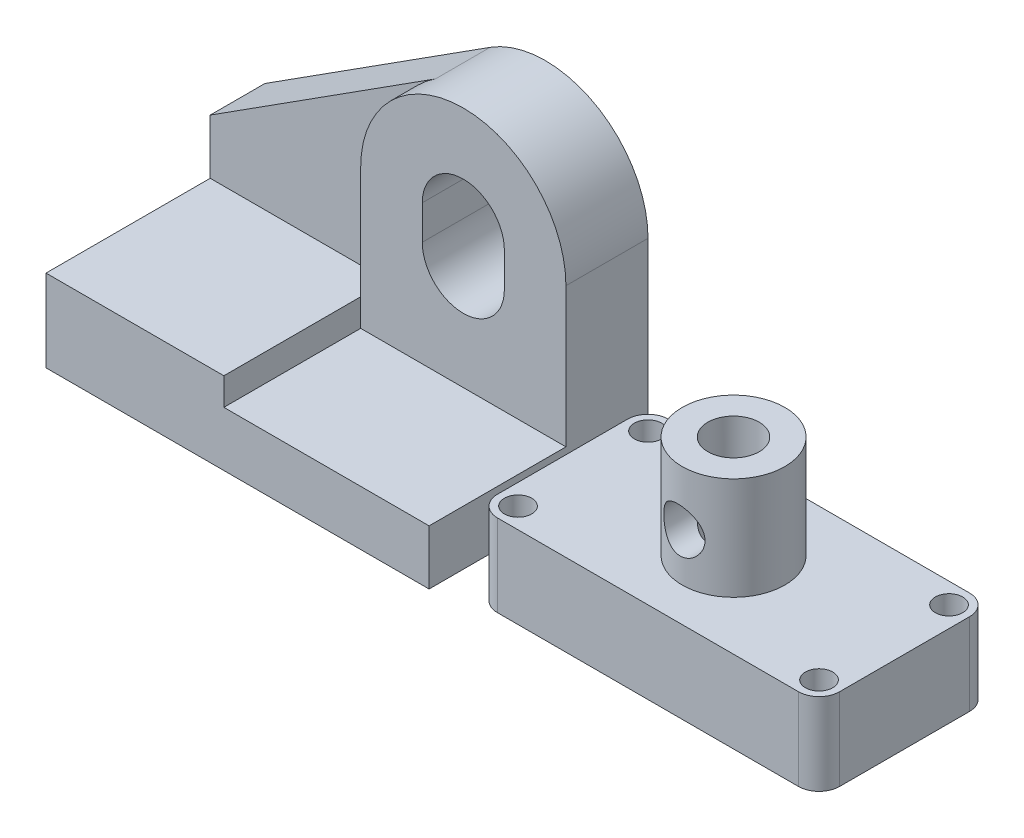
from build123d import *

# Parameters (mm, degrees)
EXTRUDE_1_DEPTH          = 32
EXTRUDE_2_DEPTH          = 8
EXTRUDE_3_DEPTH          = 12
SKETCH_2_R               = 2
EXTRUDE_4_DEPTH          = 12
SKETCH_3_R               = 7.5
SKETCH_3_R_2             = 3.75
EXTRUDE_5_DEPTH          = 15
SKETCH_3_5_R             = 3.75
CUT_EXTRUDE_2_DEPTH      = 15
CUT_EXTRUDE_3_DEPTH      = 15
CUT_EXTRUDE_3_DEPTH_BACK = 15
SKETCH_7_R               = 3.210770443


with BuildPart() as part:
    # 草图1 → 凸台-拉伸1 (new body)
    with BuildSketch(Plane.XY):
        Polygon((0, 12), (0, 0), (56, 0), (56, 8), (26, 8), (26, 12), align=None)
    extrude(amount=EXTRUDE_1_DEPTH)

    # 草图1<3> → 凸台-拉伸2 (add)
    with BuildSketch(Plane.XY):
        with BuildLine():
            Line((0, 20), (0, 12))
            Line((0, 12), (26, 12))
            Line((26, 12), (26, 28.398213008))
            ThreePointArc((26, 28.398213008), (27.844145216, 35.604008238), (32.923131319, 41.037999094))
            Line((32.923131319, 41.037999094), (0, 20))
        make_face()
    extrude(amount=EXTRUDE_2_DEPTH)

    # 草图1<4> → 凸台-拉伸3 (add)
    with BuildSketch(Plane.XY):
        with BuildLine():
            Line((26, 8), (56, 8))
            Line((56, 8), (56, 28.398213008))
            ThreePointArc((56, 28.398213008), (48.20579523, 41.554067792), (32.923131319, 41.037999094))
            ThreePointArc((32.923131319, 41.037999094), (27.844145216, 35.604008238), (26, 28.398213008))
            Line((26, 28.398213008), (26, 12))
            Line((26, 12), (26, 8))
        make_face()
        with BuildLine():
            ThreePointArc((35, 28.398213008), (41, 34.398213008), (47, 28.398213008))
            Line((47, 28.398213008), (47, 23.398213008))
            ThreePointArc((47, 23.398213008), (41, 17.398213008), (35, 23.398213008))
            Line((35, 23.398213008), (35, 28.398213008))
        make_face(mode=Mode.SUBTRACT)
    extrude(amount=EXTRUDE_3_DEPTH)


with BuildPart() as body_2:
    # 草图2 → 凸台-拉伸4 (new body)
    with BuildSketch(Plane(origin=(0, 0, 0), x_dir=(1, 0, 0), z_dir=(0, 1, 0))):
        with BuildLine():
            Line((64, -5), (108, -5))
            ThreePointArc((108, -5), (110.121320344, -5.878679656), (111, -8))
            Line((111, -8), (111, -27))
            ThreePointArc((111, -27), (110.121320344, -29.121320344), (108, -30))
            Line((108, -30), (64, -30))
            ThreePointArc((64, -30), (61.878679656, -29.121320344), (61, -27))
            Line((61, -27), (61, -8))
            ThreePointArc((61, -8), (61.878679656, -5.878679656), (64, -5))
        make_face()
        with Locations((64, -8)):
            Circle(SKETCH_2_R, mode=Mode.SUBTRACT)
        with Locations((64, -27)):
            Circle(SKETCH_2_R, mode=Mode.SUBTRACT)
        with Locations((108, -8)):
            Circle(SKETCH_2_R, mode=Mode.SUBTRACT)
        with Locations((108, -27)):
            Circle(SKETCH_2_R, mode=Mode.SUBTRACT)
    extrude(amount=EXTRUDE_4_DEPTH)

    # 草图3 → 凸台-拉伸5 (add)
    with BuildSketch(Plane(origin=(0, 12, 0), x_dir=(1, 0, 0), z_dir=(0, 1, 0))):
        with Locations((86, -17.5)):
            Circle(SKETCH_3_R)
        with Locations((86, -17.5)):
            Circle(SKETCH_3_R_2, mode=Mode.SUBTRACT)
    extrude(amount=EXTRUDE_5_DEPTH)

    # 草图3<5> → 切除-拉伸2 (cut)
    with BuildSketch(Plane(origin=(0, 12, 0), x_dir=(1, 0, 0), z_dir=(0, 1, 0))):
        with Locations((86, -17.5)):
            Circle(SKETCH_3_5_R)
    extrude(amount=-CUT_EXTRUDE_2_DEPTH, mode=Mode.SUBTRACT)

    # 草图7 → 切除-拉伸3 (cut, two sides: drawn at the far end of the back side and taken through both)
    with BuildSketch(Plane.XY.offset(17.5).offset(-CUT_EXTRUDE_3_DEPTH_BACK)):
        with Locations((85.585808846, 18.737897238)):
            Circle(SKETCH_7_R)
    extrude(amount=CUT_EXTRUDE_3_DEPTH + CUT_EXTRUDE_3_DEPTH_BACK, mode=Mode.SUBTRACT)


solid = Compound([part.part, body_2.part])
